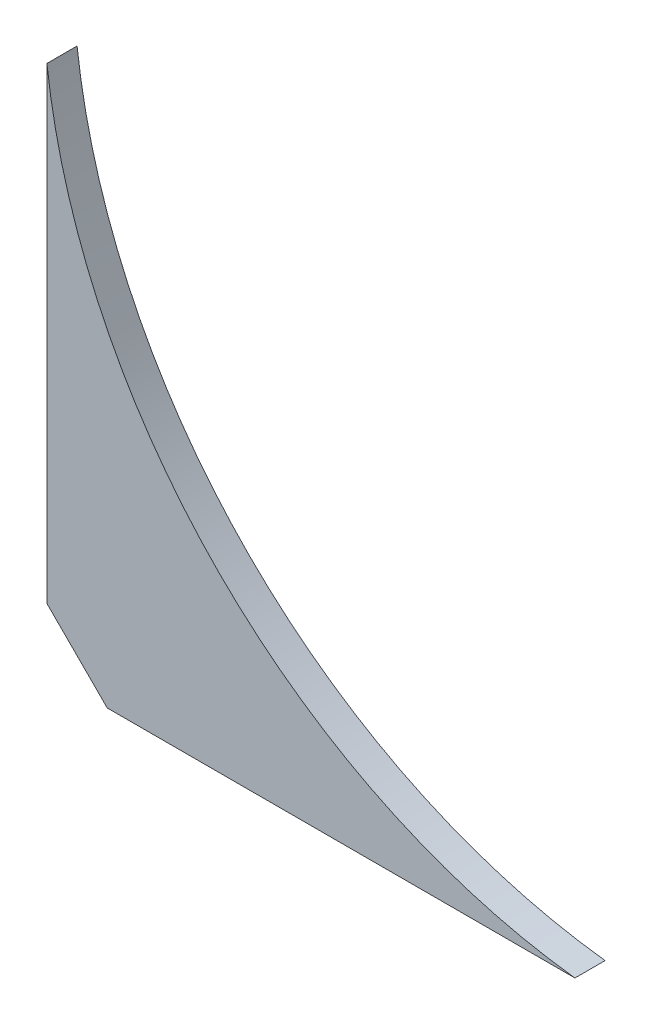
from build123d import *

# Parameters (mm, degrees)
BOSS_EXTRUDE1_DEPTH = 5


with BuildPart() as part:
    # Sketch1 → Boss-Extrude1 (new, symmetric)
    with BuildSketch(Plane.XY):
        with BuildLine():
            Line((-50.163247668, 132.91502482), (-50.163247668, -22.08497518))
            Line((-50.163247668, -22.08497518), (-30.163247668, -42.08497518))
            Line((-30.163247668, -42.08497518), (124.836752332, -42.08497518))
            ThreePointArc((124.836752332, -42.08497518), (7.017826312, 15.096098799), (-50.163247668, 132.91502482))
        make_face()
    extrude(amount=BOSS_EXTRUDE1_DEPTH, both=True)


solid = part.part
